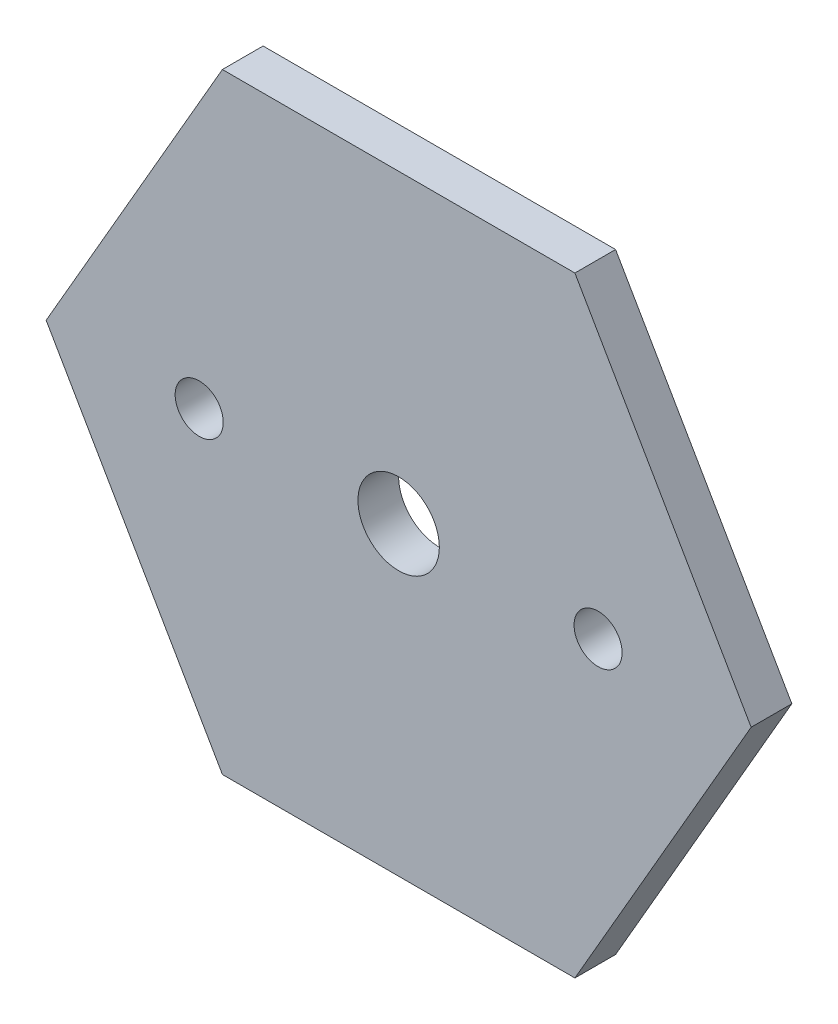
from build123d import *

# Parameters (mm, degrees)
SKETCH1_R           = 1.5
SKETCH1_R_2         = 1.499997
SKETCH1_R_3         = 2.54
BOSS_EXTRUDE1_DEPTH = 2.54


with BuildPart() as part:
    # Sketch1 → Boss-Extrude1 (new body)
    with BuildSketch(Plane.XY):
        Polygon((10.998084257, 19.050253087), (-10.998960994, 19.049746903), (-21.99704525, -0.000506184), (-10.998084257, -19.050253087), (10.998960994, -19.049746903), (21.99704525, 0.000506184), align=None)
        with Locations((-12.445999997, -0.000286401)):
            Circle(SKETCH1_R, mode=Mode.SUBTRACT)
        with Locations((12.445999997, 0.000286401)):
            Circle(SKETCH1_R_2, mode=Mode.SUBTRACT)
        Circle(SKETCH1_R_3, mode=Mode.SUBTRACT)
    extrude(amount=BOSS_EXTRUDE1_DEPTH)


solid = part.part
